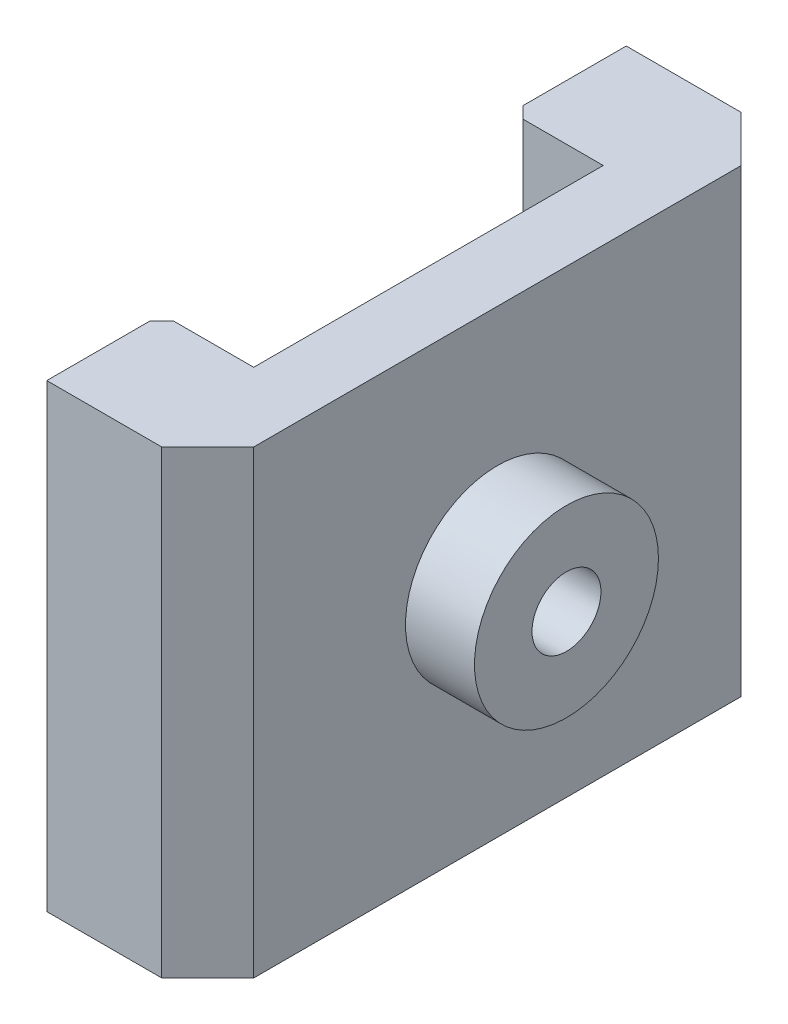
from build123d import *

# Parameters (mm, degrees)
EXTRUDE_1_DEPTH     = 20
CHAMFER_1_SIZE      = 2
CHAMFER_3_SIZE      = 0.5
SKETCH_2_R          = 4
EXTRUDE_2_DEPTH     = 3
SKETCH_3_R          = 1.5
CUT_EXTRUDE_1_DEPTH = 10


with BuildPart() as part:
    # 草图1 → 凸台-拉伸1 (new body)
    with BuildSketch(Plane(origin=(0, 0, 0), x_dir=(1, 0, 0), z_dir=(0, 1, 0))):
        Polygon((-7, 12.6), (0, 12.6), (0, -12.6), (-7, -12.6), (-7, -7.6), (-3, -7.6), (-3, 7.6), (-7, 7.6), align=None)
    extrude(amount=EXTRUDE_1_DEPTH)

    # 倒角1
    chamfer_1_edges = [part.edges().sort_by_distance(p)[0] for p in [
        (0, 10, -12.6),
        (0, 10, 12.6),
    ]]
    chamfer(chamfer_1_edges, length=CHAMFER_1_SIZE)

    # 倒角3
    chamfer_3_edges = [part.edges().sort_by_distance(p)[0] for p in [
        (-7, 10, 7.6),
        (-7, 10, -7.6),
    ]]
    chamfer(chamfer_3_edges, length=CHAMFER_3_SIZE)

    # 草图2 → 凸台-拉伸2 (add)
    with BuildSketch(Plane(origin=(0, 0, 0), x_dir=(0, 0, -1), z_dir=(1, 0, 0))):
        with Locations((0, 10)):
            Circle(SKETCH_2_R)
    extrude(amount=EXTRUDE_2_DEPTH)

    # 草图3 → 切除-拉伸1 (cut)
    with BuildSketch(Plane(origin=(3, 0, 0), x_dir=(0, 0, -1), z_dir=(1, 0, 0))):
        with Locations((0, 10)):
            Circle(SKETCH_3_R)
    extrude(amount=-CUT_EXTRUDE_1_DEPTH, mode=Mode.SUBTRACT)


solid = part.part
